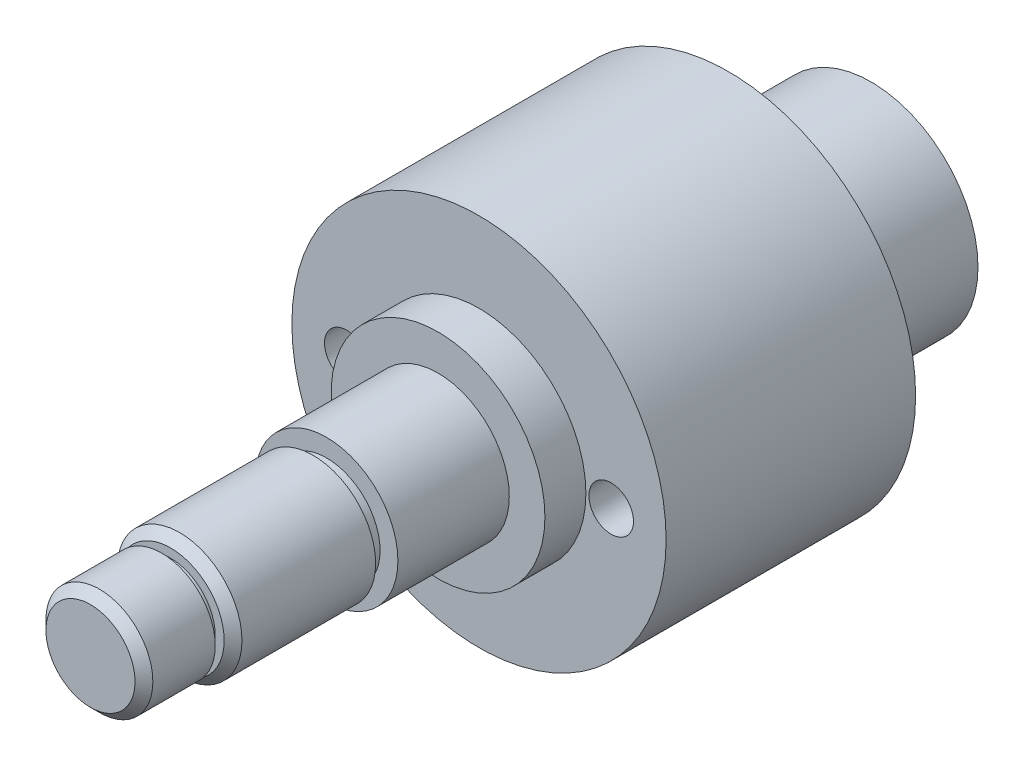
from build123d import *

# Parameters (mm, degrees)
ESQUISSE1_R             = 6
BOSS_EXTRU_1_DEPTH      = 8
ESQUISSE2_R             = 10.5
ESQUISSE2_R_2           = 1.25
BOSS_EXTRU_2_DEPTH      = 14
ESQUISSE3_R             = 6
BOSS_EXTRU_3_DEPTH      = 2.3
ESQUISSE4_R             = 4
BOSS_EXTRU_4_DEPTH      = 6.25
ESQUISSE5_R             = 3
BOSS_EXTRU_5_DEPTH      = 0.75
ESQUISSE7_R             = 3.5
BOSS_EXTRU_6_DEPTH      = 8
ESQUISSE8_R             = 2.5
BOSS_EXTRU_7_DEPTH      = 0.5
ESQUISSE9_R             = 3
BOSS_EXTRU_8_DEPTH      = 4
ESQUISSE10_R            = 4.75
ENL_V_MAT_EXTRU_1_DEPTH = 21
CHANFREIN1_SIZE         = 0.5
CHANFREIN2_SIZE         = 0.5


with BuildPart() as part:
    # Esquisse1 → Boss.-Extru.1 (new body)
    with BuildSketch(Plane.XY):
        Circle(ESQUISSE1_R)
    extrude(amount=BOSS_EXTRU_1_DEPTH)

    # Esquisse2 → Boss.-Extru.2 (add)
    with BuildSketch(Plane.XY.offset(8)):
        Circle(ESQUISSE2_R)
        with Locations((-7.418567839, -0.026589849)):
            Circle(ESQUISSE2_R_2, mode=Mode.SUBTRACT)
        with Locations((7.418567839, -0.026589849)):
            Circle(ESQUISSE2_R_2, mode=Mode.SUBTRACT)
    extrude(amount=BOSS_EXTRU_2_DEPTH)

    # Esquisse3 → Boss.-Extru.3 (add)
    with BuildSketch(Plane.XY.offset(22)):
        Circle(ESQUISSE3_R)
    extrude(amount=BOSS_EXTRU_3_DEPTH)

    # Esquisse4 → Boss.-Extru.4 (add)
    with BuildSketch(Plane.XY.offset(24.3)):
        Circle(ESQUISSE4_R)
    extrude(amount=BOSS_EXTRU_4_DEPTH)

    # Esquisse5 → Boss.-Extru.5 (add)
    with BuildSketch(Plane.XY.offset(30.55)):
        Circle(ESQUISSE5_R)
    extrude(amount=BOSS_EXTRU_5_DEPTH)

    # Esquisse7 → Boss.-Extru.6 (add)
    with BuildSketch(Plane.XY.offset(31.3)):
        Circle(ESQUISSE7_R)
    extrude(amount=BOSS_EXTRU_6_DEPTH)

    # Esquisse8 → Boss.-Extru.7 (add)
    with BuildSketch(Plane.XY.offset(39.3)):
        Circle(ESQUISSE8_R)
    extrude(amount=BOSS_EXTRU_7_DEPTH)

    # Esquisse9 → Boss.-Extru.8 (add)
    with BuildSketch(Plane.XY.offset(39.8)):
        Circle(ESQUISSE9_R)
    extrude(amount=BOSS_EXTRU_8_DEPTH)

    # Esquisse10 → Enlèv. mat.-Extru.1 (cut)
    with BuildSketch(Plane(origin=(0, 0, 0), x_dir=(-1, 0, 0), z_dir=(0, 0, -1))):
        Circle(ESQUISSE10_R)
    extrude(amount=-ENL_V_MAT_EXTRU_1_DEPTH, mode=Mode.SUBTRACT)

    # Chanfrein1
    chanfrein1_edges = [part.edges().sort_by_distance(p)[0] for p in [
        (-3.5, 0, 39.3),
    ]]
    chamfer(chanfrein1_edges, length=CHANFREIN1_SIZE)

    # Chanfrein2
    chanfrein2_edges = [part.edges().sort_by_distance(p)[0] for p in [
        (-3, 0, 43.8),
    ]]
    chamfer(chanfrein2_edges, length=CHANFREIN2_SIZE)


solid = part.part
